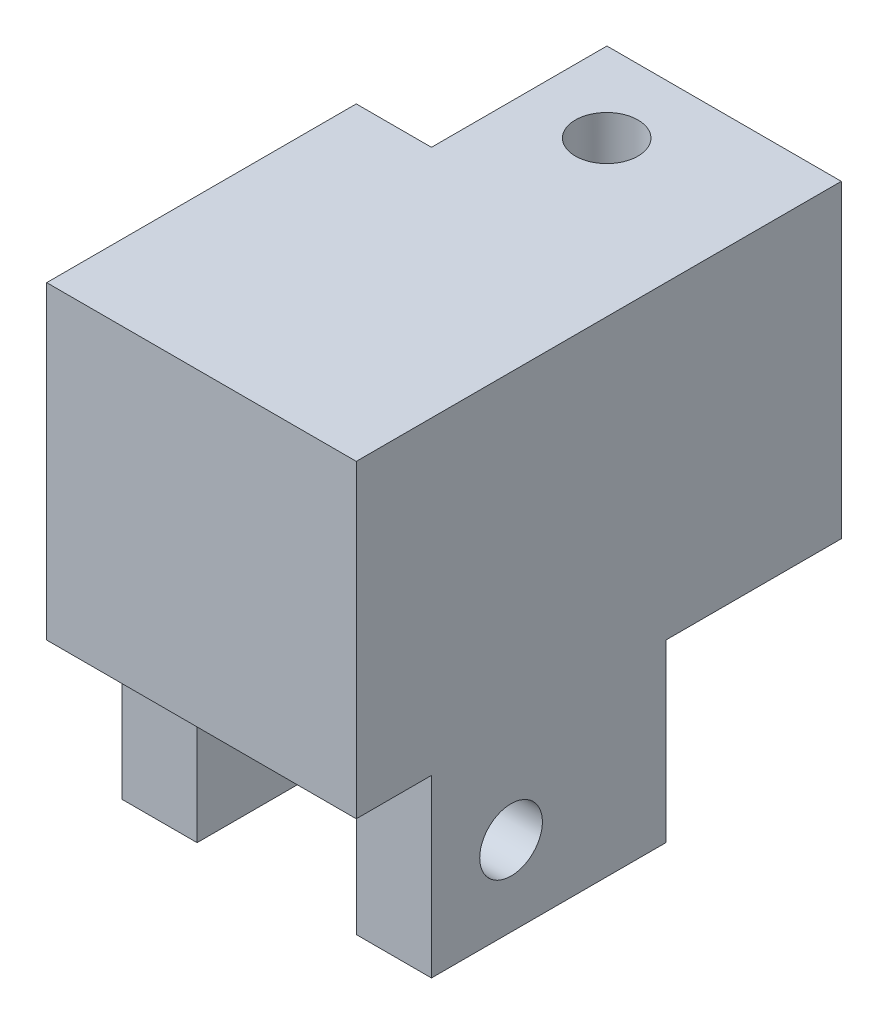
from build123d import *

# Parameters (mm, degrees)
SKETCH_1_W          = 24.7
SKETCH_1_H          = 24.7
SKETCH_1_W_2        = 12.7
SKETCH_1_H_2        = 12.7
EXTRUDE_2_DEPTH     = 24.7
EXTRUDE_3_DEPTH     = 14
EXTRUDE_5_DEPTH     = 14
SKETCH_6_R          = 2.5
CUT_EXTRUDE_1_DEPTH = 39.169817919
SKETCH_7_R          = 2.5
CUT_EXTRUDE_2_DEPTH = 44.755028282


with BuildPart() as part:
    # 草图1 → 凸台-拉伸2 (new body)
    # profile 1 of 2: a face of its own
    with BuildSketch(Plane(origin=(0, 0, 0), x_dir=(1, 0, 0), z_dir=(0, 1, 0))):
        Rectangle(SKETCH_1_W, SKETCH_1_H)
        Rectangle(SKETCH_1_W_2, SKETCH_1_H_2, mode=Mode.SUBTRACT)
    # profile 2 of 2: a face of its own
    with BuildSketch(Plane(origin=(0, 0, 0), x_dir=(1, 0, 0), z_dir=(0, 1, 0))):
        Rectangle(SKETCH_1_W_2, SKETCH_1_H_2)
    extrude(amount=EXTRUDE_2_DEPTH)

    # 草图3 → 凸台-拉伸3 (add)
    with BuildSketch(Plane.XZ):
        Polygon((-6.35, -6.35), (-6.35, 6.35), (-12.35, 6.35), (-12.35, -12.35), (12.35, -12.35), (12.35, 6.35), (6.35, 6.35), (6.35, -6.35), align=None)
    extrude(amount=EXTRUDE_3_DEPTH)

    # 草图5 → 凸台-拉伸5 (add)
    with BuildSketch(Plane(origin=(0, 0, -12.35), x_dir=(-1, 0, 0), z_dir=(0, 0, -1))):
        Polygon((6.35, 24.7), (-12.35, 24.7), (-12.35, 0), (6.35, 0), (6.35, 6), (-6.35, 6), (-6.35, 18.7), (6.35, 18.7), align=None)
    extrude(amount=EXTRUDE_5_DEPTH)

    # 草图6 → 切除-拉伸1 (cut, through all)
    with BuildSketch(Plane.XZ):
        with Locations(Location((0, -19.98, 0), (0, 0, 270))):
            Circle(SKETCH_6_R)
    extrude(amount=-CUT_EXTRUDE_1_DEPTH, mode=Mode.SUBTRACT)

    # 草图7 → 切除-拉伸2 (cut, through all)
    with BuildSketch(Plane.ZY.offset(12.35)):
        with Locations((0, -7.63)):
            Circle(SKETCH_7_R)
    extrude(amount=-CUT_EXTRUDE_2_DEPTH, mode=Mode.SUBTRACT)


solid = part.part
